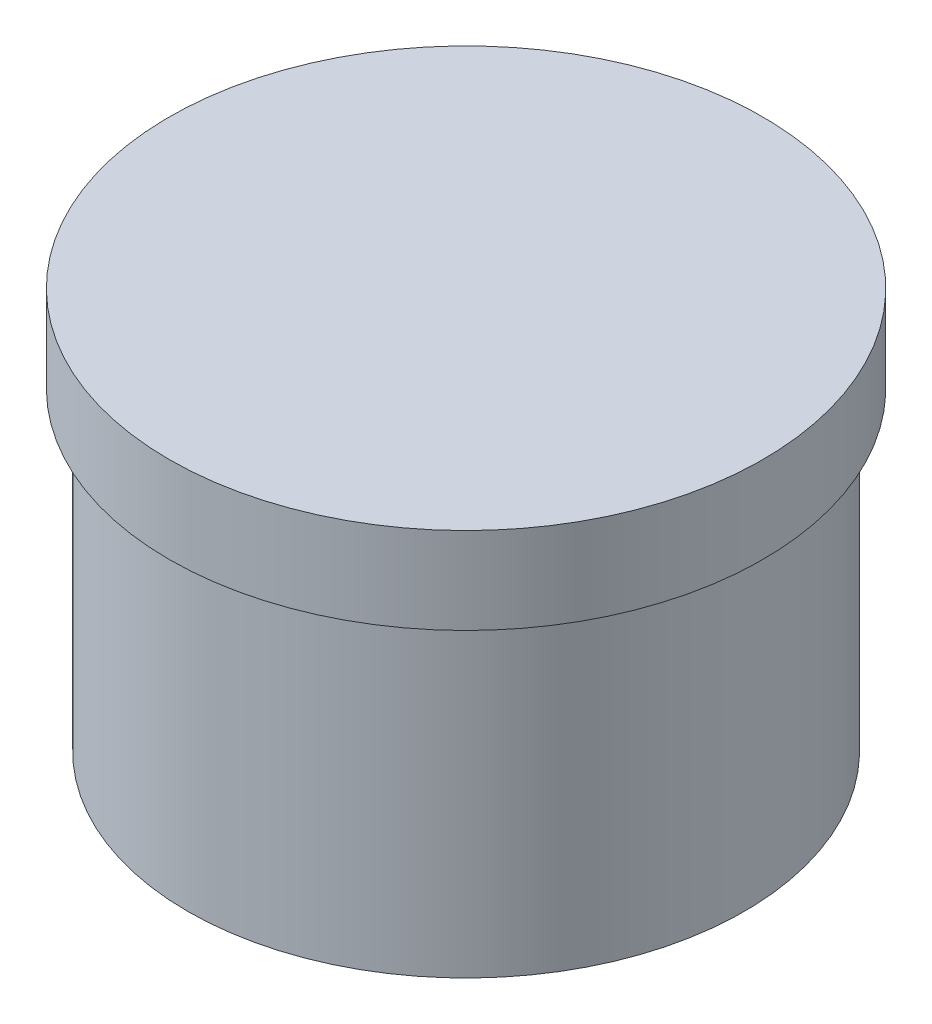
from build123d import *

# Parameters (mm, degrees)
SKETCH1_R           = 22.5
BOSS_EXTRUDE1_DEPTH = 25.4
SKETCH2_R           = 24
BOSS_EXTRUDE2_DEPTH = 7


with BuildPart() as part:
    # Sketch1 → Boss-Extrude1 (new body)
    with BuildSketch(Plane(origin=(0, 0, 0), x_dir=(1, 0, 0), z_dir=(0, 1, 0))):
        with Locations(Location((0, 0, 0), (0, 0, 270))):
            Circle(SKETCH1_R)
    extrude(amount=-BOSS_EXTRUDE1_DEPTH)

    # Sketch2 → Boss-Extrude2 (add)
    with BuildSketch(Plane(origin=(0, 0, 0), x_dir=(1, 0, 0), z_dir=(0, 1, 0))):
        with Locations(Location((0, 0, 0), (0, 0, 270))):
            Circle(SKETCH2_R)
    extrude(amount=BOSS_EXTRUDE2_DEPTH)


solid = part.part
